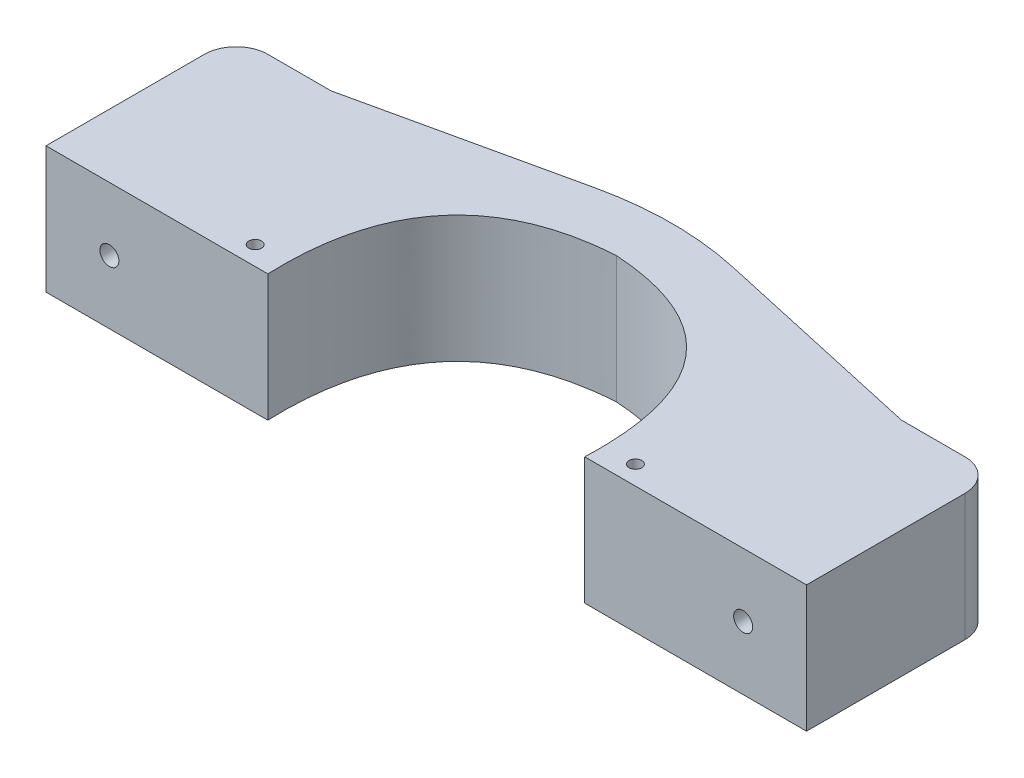
from build123d import *

# Parameters (mm, degrees)
BOSS_EXTRUDE1_DEPTH = 20
FILLET1_R           = 50
FILLET2_R           = 5
SKETCH3_R           = 1.5
CUT_EXTRUDE1_DEPTH  = 20
SKETCH4_R           = 2.5
CUT_EXTRUDE2_DEPTH  = 10
SKETCH5_R           = 1
CUT_EXTRUDE3_DEPTH  = 20


with BuildPart() as part:
    # Sketch2 → Boss-Extrude1 (new body)
    with BuildSketch(Plane(origin=(0, 0, 0), x_dir=(1, 0, 0), z_dir=(0, 1, 0))):
        with BuildLine():
            Line((25, -30), (60, -30))
            Line((60, -30), (60, 0))
            Line((60, 0), (45, 0))
            Line((45, 0), (0, 10))
            Line((0, 10), (-45, 0))
            Line((-45, 0), (-60, 0))
            Line((-60, 0), (-60, -30))
            Line((-60, -30), (-25, -30))
            add(Edge.make_bspline(
                [(0, 0), (-26.0775505, -1.658562804), (-25, -30)],
                knots=[0, 0, 0, 1, 1, 1], degree=2))
            add(Edge.make_bspline(
                [(0, 0), (26.0775505, -1.658562804), (25, -30)],
                knots=[0, 0, 0, 1, 1, 1], degree=2))
        make_face()
    extrude(amount=BOSS_EXTRUDE1_DEPTH)

    # Fillet1
    fillet1_edges = [part.edges().sort_by_distance(p)[0] for p in [
        (0, 10, -10),
    ]]
    fillet(fillet1_edges, radius=FILLET1_R)

    # Fillet2
    fillet2_edges = [part.edges().sort_by_distance(p)[0] for p in [
        (-60, 10, 0),
        (60, 10, 0),
    ]]
    fillet(fillet2_edges, radius=FILLET2_R)

    # Sketch3 → Cut-Extrude1 (cut)
    with BuildSketch(Plane.XY.offset(30)):
        with Locations((50, 10)):
            Circle(SKETCH3_R)
    cut_extrude1 = extrude(amount=-CUT_EXTRUDE1_DEPTH, mode=Mode.SUBTRACT)

    # Sketch4 → Cut-Extrude2 (cut)
    with BuildSketch(Plane(origin=(0, 0, 0), x_dir=(-1, 0, 0), z_dir=(0, 0, -1))):
        with Locations((-50, 10)):
            Circle(SKETCH4_R)
    cut_extrude2 = extrude(amount=-CUT_EXTRUDE2_DEPTH, mode=Mode.SUBTRACT)

    # Mirror1: Cut-Extrude1, Cut-Extrude2 across plane
    add(cut_extrude1.mirror(Plane(origin=(0, 0, 0), x_dir=(0, 0, 1), z_dir=(1, 0, 0))), mode=Mode.SUBTRACT)
    add(cut_extrude2.mirror(Plane(origin=(0, 0, 0), x_dir=(0, 0, 1), z_dir=(1, 0, 0))), mode=Mode.SUBTRACT)

    # Sketch5 → Cut-Extrude3 (cut)
    with BuildSketch(Plane(origin=(0, 20, 0), x_dir=(1, 0, 0), z_dir=(0, 1, 0))):
        with Locations(Location((30, -27, 0), (0, 0, 270))):
            Circle(SKETCH5_R)
    cut_extrude3 = extrude(amount=-CUT_EXTRUDE3_DEPTH, mode=Mode.SUBTRACT)

    # Mirror2: Cut-Extrude3 across plane
    add(cut_extrude3.mirror(Plane(origin=(0, 0, 0), x_dir=(0, 0, 1), z_dir=(1, 0, 0))), mode=Mode.SUBTRACT)


solid = part.part
